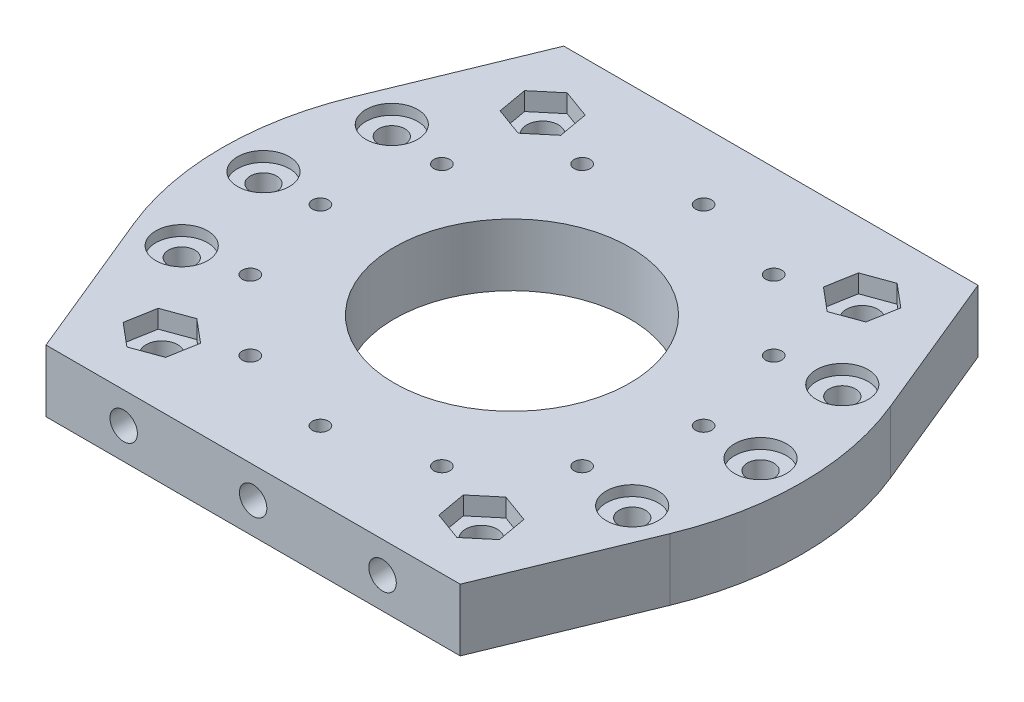
from build123d import *

# Parameters (mm, degrees)
RA_HARM_DEPTH        = 6
SKETCH2_R            = 22.75
CUT_EXTRUDE1_DEPTH   = 12
SKETCH3_R            = 1.55
M4_THROUGH_DEPTH     = 12
SKETCH5_R            = 2.65
M5X8_DRILL2_DEPTH    = 8
CUT_EXTRUDE_START    = -8
SKETCH_8_R           = 2.65
CUT_EXTRUDE_6_DEPTH  = 8
SKETCH_9_R           = 2.55
SKETCH_9_R_2         = 3.05
CUT_EXTRUDE_8_DEPTH  = 12
CUT_EXTRUDE_9_DEPTH  = 3.5
CUT_EXTRUDE_10_DEPTH = 3
SKETCH_12_R          = 5
CUT_EXTRUDE_11_DEPTH = 2
SKETCH_13_R          = 39.75
SKETCH_13_R_2        = 33.75
EXTRUDE_1_DEPTH      = 4
SKETCH_14_R          = 4
CUT_EXTRUDE_12_DEPTH = 4


with BuildPart() as part:
    # Sketch1 → КрышкаRa_Harm (new, symmetric)
    with BuildSketch(Plane(origin=(0, 0, 0), x_dir=(1, 0, 0), z_dir=(0, 1, 0))):
        with BuildLine():
            Line((40, 50), (-40, 50))
            Line((-40, 50), (-51.798872756, 21.280901795))
            ThreePointArc((-51.798872756, 21.280901795), (-56, 0), (-51.798872756, -21.280901795))
            Line((-51.798872756, -21.280901795), (-40, -50))
            Line((-40, -50), (40, -50))
            Line((40, -50), (51.798872756, -21.280901795))
            ThreePointArc((51.798872756, -21.280901795), (56, 0), (51.798872756, 21.280901795))
            Line((51.798872756, 21.280901795), (40, 50))
        make_face()
    extrude(amount=RA_HARM_DEPTH, both=True)

    # Sketch2 → Cut-Extrude1 (cut)
    with BuildSketch(Plane(origin=(0, 6, 0), x_dir=(1, 0, 0), z_dir=(0, 1, 0))):
        with Locations(Location((0, 0, 0), (0, 0, 270))):
            Circle(SKETCH2_R)
    extrude(amount=-CUT_EXTRUDE1_DEPTH, mode=Mode.SUBTRACT)

    # Sketch3 → M4_through (cut)
    with BuildSketch(Plane(origin=(0, 6, 0), x_dir=(1, 0, 0), z_dir=(0, 1, 0))):
        with Locations(Location((0, 37, 0), (0, 0, 270))):
            Circle(SKETCH3_R)
        with Locations(Location((18.5, 32.04293994, 0), (0, 0, 270))):
            Circle(SKETCH3_R)
        with Locations(Location((32.04293994, 18.5, 0), (0, 0, 270))):
            Circle(SKETCH3_R)
        with Locations(Location((37, 0, 0), (0, 0, 270))):
            Circle(SKETCH3_R)
        with Locations(Location((32.04293994, -18.5, 0), (0, 0, 270))):
            Circle(SKETCH3_R)
        with Locations(Location((18.5, -32.04293994, 0), (0, 0, 270))):
            Circle(SKETCH3_R)
        with Locations(Location((0, -37, 0), (0, 0, 270))):
            Circle(SKETCH3_R)
        with Locations(Location((-18.5, -32.04293994, 0), (0, 0, 270))):
            Circle(SKETCH3_R)
        with Locations(Location((-32.04293994, -18.5, 0), (0, 0, 270))):
            Circle(SKETCH3_R)
        with Locations(Location((-37, 0, 0), (0, 0, 270))):
            Circle(SKETCH3_R)
        with Locations(Location((-32.04293994, 18.5, 0), (0, 0, 270))):
            Circle(SKETCH3_R)
        with Locations(Location((-18.5, 32.04293994, 0), (0, 0, 270))):
            Circle(SKETCH3_R)
    extrude(amount=-M4_THROUGH_DEPTH, mode=Mode.SUBTRACT)

    # Sketch5 → M5x8_DRILL2 (cut)
    with BuildSketch(Plane.XY.offset(50)):
        with Locations((-25, 0)):
            Circle(SKETCH5_R)
        with Locations(Location((25, 0, 0), (0, 0, 180))):
            Circle(SKETCH5_R)
        Circle(SKETCH5_R)
    extrude(amount=-M5X8_DRILL2_DEPTH, mode=Mode.SUBTRACT)

    # Эскиз8 → Вырез-Вытянуть6 (cut)
    with BuildSketch(Plane(origin=(0, 0, -50), x_dir=(-1, 0, 0), z_dir=(0, 0, -1)).offset(CUT_EXTRUDE_START)):
        with Locations((-25, 0)):
            Circle(SKETCH_8_R)
        with Locations(Location((0, 0, 0), (0, 0, 180))):
            Circle(SKETCH_8_R)
        with Locations(Location((25, 0, 0), (0, 0, 180))):
            Circle(SKETCH_8_R)
    extrude(amount=CUT_EXTRUDE_6_DEPTH, mode=Mode.SUBTRACT)

    # Эскиз9 → Вырез-Вытянуть8 (cut)
    with BuildSketch(Plane.XZ.offset(6)):
        with Locations(Location((-48, 0, 0), (0, 0, 270))):
            Circle(SKETCH_9_R)
        with Locations(Location((-43.502773778, -20.285676564, 0), (0, 0, 270))):
            Circle(SKETCH_9_R)
        with Locations(Location((-43.502773778, 20.285676564, 0), (0, 0, 270))):
            Circle(SKETCH_9_R)
        with Locations(Location((-30.853805265, 36.77013327, 0), (0, 0, 270))):
            Circle(SKETCH_9_R_2)
        with Locations(Location((-30.853805265, -36.77013327, 0), (0, 0, 90))):
            Circle(SKETCH_9_R_2)
        with Locations(Location((30.853805265, -36.77013327, 0), (0, 0, 270))):
            Circle(SKETCH_9_R_2)
        with Locations(Location((30.853805265, 36.77013327, 0), (0, 0, 90))):
            Circle(SKETCH_9_R_2)
        with Locations(Location((43.502773778, 20.285676564, 0), (0, 0, 90))):
            Circle(SKETCH_9_R)
        with Locations(Location((43.502773778, -20.285676564, 0), (0, 0, 90))):
            Circle(SKETCH_9_R)
        with Locations(Location((48, 0, 0), (0, 0, 90))):
            Circle(SKETCH_9_R)
    extrude(amount=-CUT_EXTRUDE_8_DEPTH, mode=Mode.SUBTRACT)

    # Эскиз10 → Вырез-Вытянуть9 (cut)
    with BuildSketch(Plane(origin=(0, 6, 0), x_dir=(1, 0, 0), z_dir=(0, 1, 0))):
        Polygon((-26.386818014, 40.518380625), (-31.866389068, 42.512781385), (-36.333376319, 38.76453403), (-35.320792516, 33.021885915), (-29.841221462, 31.027485155), (-25.374234211, 34.775732509), align=None)
        Polygon((25.374234211, 34.775732509), (29.841221462, 31.027485155), (35.320792516, 33.021885915), (36.333376319, 38.76453403), (31.866389068, 42.512781385), (26.386818014, 40.518380625), align=None)
        Polygon((-25.374234211, -34.775732509), (-29.841221462, -31.027485155), (-35.320792516, -33.021885915), (-36.333376319, -38.76453403), (-31.866389068, -42.512781385), (-26.386818014, -40.518380625), align=None)
        Polygon((35.320792516, -33.021885915), (29.841221462, -31.027485155), (25.374234211, -34.775732509), (26.386818014, -40.518380625), (31.866389068, -42.512781385), (36.333376319, -38.76453403), align=None)
    extrude(amount=-CUT_EXTRUDE_9_DEPTH, mode=Mode.SUBTRACT)

    # Эскиз11 → Вырез-Вытянуть10 (cut)
    with BuildSketch(Plane.XZ.offset(6)):
        Polygon((21.45, 33.746123234), (18.5, 35.449306528), (15.55, 33.746123234), (15.55, 30.339756646), (18.5, 28.636573352), (21.45, 30.339756646), align=None)
        Polygon((1.703183294, 39.95), (-1.703183294, 39.95), (-3.406366588, 37), (-1.703183294, 34.05), (1.703183294, 34.05), (3.406366588, 37), align=None)
        Polygon((35.449306528, 18.5), (33.746123234, 21.45), (30.339756646, 21.45), (28.636573352, 18.5), (30.339756646, 15.55), (33.746123234, 15.55), align=None)
        Polygon((39.95, -1.703183294), (39.95, 1.703183294), (37, 3.406366588), (34.05, 1.703183294), (34.05, -1.703183294), (37, -3.406366588), align=None)
        Polygon((33.746123234, -21.45), (35.449306528, -18.5), (33.746123234, -15.55), (30.339756646, -15.55), (28.636573352, -18.5), (30.339756646, -21.45), align=None)
        Polygon((18.5, -35.449306528), (21.45, -33.746123234), (21.45, -30.339756646), (18.5, -28.636573352), (15.55, -30.339756646), (15.55, -33.746123234), align=None)
        Polygon((-1.703183294, -39.95), (1.703183294, -39.95), (3.406366588, -37), (1.703183294, -34.05), (-1.703183294, -34.05), (-3.406366588, -37), align=None)
        Polygon((-21.45, -33.746123234), (-18.5, -35.449306528), (-15.55, -33.746123234), (-15.55, -30.339756646), (-18.5, -28.636573352), (-21.45, -30.339756646), align=None)
        Polygon((-35.449306528, -18.5), (-33.746123234, -21.45), (-30.339756646, -21.45), (-28.636573352, -18.5), (-30.339756646, -15.55), (-33.746123234, -15.55), align=None)
        Polygon((-39.95, 1.703183294), (-39.95, -1.703183294), (-37, -3.406366588), (-34.05, -1.703183294), (-34.05, 1.703183294), (-37, 3.406366588), align=None)
        Polygon((-33.746123234, 21.45), (-35.449306528, 18.5), (-33.746123234, 15.55), (-30.339756646, 15.55), (-28.636573352, 18.5), (-30.339756646, 21.45), align=None)
        Polygon((-18.5, 35.449306528), (-21.45, 33.746123234), (-21.45, 30.339756646), (-18.5, 28.636573352), (-15.55, 30.339756646), (-15.55, 33.746123234), align=None)
    extrude(amount=-CUT_EXTRUDE_10_DEPTH, mode=Mode.SUBTRACT)

    # Эскиз12 → Вырез-Вытянуть11 (cut)
    with BuildSketch(Plane(origin=(0, 6, 0), x_dir=(1, 0, 0), z_dir=(0, 1, 0))):
        with Locations(Location((-43.502773778, 20.285676564, 0), (0, 0, 270))):
            Circle(SKETCH_12_R)
        with Locations(Location((-48, 0, 0), (0, 0, 270))):
            Circle(SKETCH_12_R)
        with Locations(Location((-43.502773778, -20.285676564, 0), (0, 0, 270))):
            Circle(SKETCH_12_R)
        with Locations(Location((43.502773778, -20.285676564, 0), (0, 0, 270))):
            Circle(SKETCH_12_R)
        with Locations(Location((48, 0, 0), (0, 0, 270))):
            Circle(SKETCH_12_R)
        with Locations(Location((43.502773778, 20.285676564, 0), (0, 0, 270))):
            Circle(SKETCH_12_R)
    extrude(amount=-CUT_EXTRUDE_11_DEPTH, mode=Mode.SUBTRACT)


with BuildPart() as body_2:
    # Эскиз13 → Бобышка-Вытянуть1 (new body)
    with BuildSketch(Plane.XZ.offset(6)):
        with Locations(Location((0, 0, 0), (0, 0, 270))):
            Circle(SKETCH_13_R)
        with Locations(Location((0, 0, 0), (0, 0, 270))):
            Circle(SKETCH_13_R_2, mode=Mode.SUBTRACT)
    extrude(amount=EXTRUDE_1_DEPTH)

    # Эскиз14 → Вырез-Вытянуть12 (cut)
    with BuildSketch(Plane.XZ.offset(10)):
        with Locations((0, 37)):
            Circle(SKETCH_14_R)
        with Locations((18.5, 32.04293994)):
            Circle(SKETCH_14_R)
        with Locations((32.04293994, 18.5)):
            Circle(SKETCH_14_R)
        with Locations((37, 0)):
            Circle(SKETCH_14_R)
        with Locations((32.04293994, -18.5)):
            Circle(SKETCH_14_R)
        with Locations((18.5, -32.04293994)):
            Circle(SKETCH_14_R)
        with Locations((0, -37)):
            Circle(SKETCH_14_R)
        with Locations((-18.5, -32.04293994)):
            Circle(SKETCH_14_R)
        with Locations((-32.04293994, -18.5)):
            Circle(SKETCH_14_R)
        with Locations((-37, 0)):
            Circle(SKETCH_14_R)
        with Locations((-32.04293994, 18.5)):
            Circle(SKETCH_14_R)
        with Locations((-18.5, 32.04293994)):
            Circle(SKETCH_14_R)
    extrude(amount=-CUT_EXTRUDE_12_DEPTH, mode=Mode.SUBTRACT)


with BuildPart() as cut_extrude_12_piece_1:
    # of the separate pieces the step leaves, piece 1, a body of its own (cut_extrude_12_pieces)
    add(body_2.part.solids().sort_by_distance((17.212474916, -6, 35.830060107))[0])


with BuildPart() as cut_extrude_12_piece_2:
    # of the separate pieces the step leaves, piece 2, a body of its own (cut_extrude_12_pieces)
    add(body_2.part.solids().sort_by_distance((-3.008589514, -6, 39.63597973))[0])


with BuildPart() as cut_extrude_12_piece_3:
    # of the separate pieces the step leaves, piece 3, a body of its own (cut_extrude_12_pieces)
    add(body_2.part.solids().sort_by_distance((-22.423504814, -6, 32.821470593))[0])


with BuildPart() as cut_extrude_12_piece_4:
    # of the separate pieces the step leaves, piece 4, a body of its own (cut_extrude_12_pieces)
    add(body_2.part.solids().sort_by_distance((32.821470593, -6, 22.423504814))[0])


with BuildPart() as cut_extrude_12_piece_5:
    # of the separate pieces the step leaves, piece 5, a body of its own (cut_extrude_12_pieces)
    add(body_2.part.solids().sort_by_distance((-35.830060107, -6, 17.212474916))[0])


with BuildPart() as cut_extrude_12_piece_6:
    # of the separate pieces the step leaves, piece 6, a body of its own (cut_extrude_12_pieces)
    add(body_2.part.solids().sort_by_distance((-39.63597973, -6, -3.008589514))[0])


with BuildPart() as cut_extrude_12_piece_7:
    # of the separate pieces the step leaves, piece 7, a body of its own (cut_extrude_12_pieces)
    add(body_2.part.solids().sort_by_distance((39.63597973, -6, 3.008589514))[0])


with BuildPart() as cut_extrude_12_piece_8:
    # of the separate pieces the step leaves, piece 8, a body of its own (cut_extrude_12_pieces)
    add(body_2.part.solids().sort_by_distance((-32.821470593, -6, -22.423504814))[0])


with BuildPart() as cut_extrude_12_piece_9:
    # of the separate pieces the step leaves, piece 9, a body of its own (cut_extrude_12_pieces)
    add(body_2.part.solids().sort_by_distance((35.830060107, -6, -17.212474916))[0])


with BuildPart() as cut_extrude_12_piece_10:
    # of the separate pieces the step leaves, piece 10, a body of its own (cut_extrude_12_pieces)
    add(body_2.part.solids().sort_by_distance((-17.212474916, -6, -35.830060107))[0])


with BuildPart() as cut_extrude_12_piece_11:
    # of the separate pieces the step leaves, piece 11, a body of its own (cut_extrude_12_pieces)
    add(body_2.part.solids().sort_by_distance((22.423504814, -6, -32.821470593))[0])


with BuildPart() as cut_extrude_12_piece_12:
    # of the separate pieces the step leaves, piece 12, a body of its own (cut_extrude_12_pieces)
    add(body_2.part.solids().sort_by_distance((3.008589514, -6, -39.63597973))[0])


solid = Compound([part.part, cut_extrude_12_piece_1.part, cut_extrude_12_piece_2.part, cut_extrude_12_piece_3.part, cut_extrude_12_piece_4.part, cut_extrude_12_piece_5.part, cut_extrude_12_piece_6.part, cut_extrude_12_piece_7.part, cut_extrude_12_piece_8.part, cut_extrude_12_piece_9.part, cut_extrude_12_piece_10.part, cut_extrude_12_piece_11.part, cut_extrude_12_piece_12.part])
